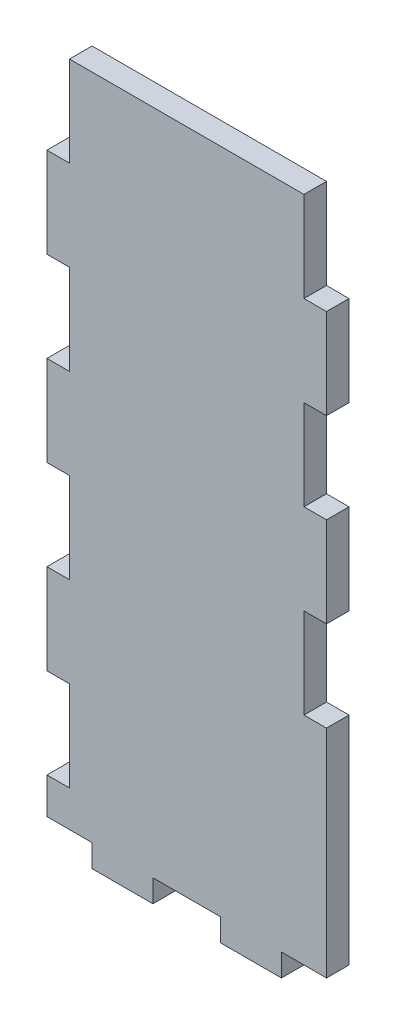
from build123d import *

# Parameters (mm, degrees)
BOSS_EXTRUDE1_DEPTH = 6.35


with BuildPart() as part:
    # Sketch2 → Boss-Extrude1 (new body)
    with BuildSketch(Plane.XY):
        Polygon((26.67, -100.33), (26.67, -93.98), (39.37, -93.98), (39.37, -33.02), (33.02, -33.02), (33.02, -7.62), (39.37, -7.62), (39.37, 17.78), (33.02, 17.78), (33.02, 43.18), (39.37, 43.18), (39.37, 68.58), (33.02, 68.58), (33.02, 93.98), (-33.02, 93.98), (-33.02, 68.58), (-39.37, 68.58), (-39.37, 43.18), (-33.02, 43.18), (-33.02, 17.78), (-39.37, 17.78), (-39.37, -7.62), (-33.02, -7.62), (-33.02, -33.02), (-39.37, -33.02), (-39.37, -58.42), (-33.02, -58.42), (-33.02, -83.82), (-39.37, -83.82), (-39.37, -93.98), (-26.67, -93.98), (-26.67, -100.33), (-9.525, -100.33), (-9.525, -93.98), (9.525, -93.98), (9.525, -100.33), align=None)
    extrude(amount=BOSS_EXTRUDE1_DEPTH)


solid = part.part
